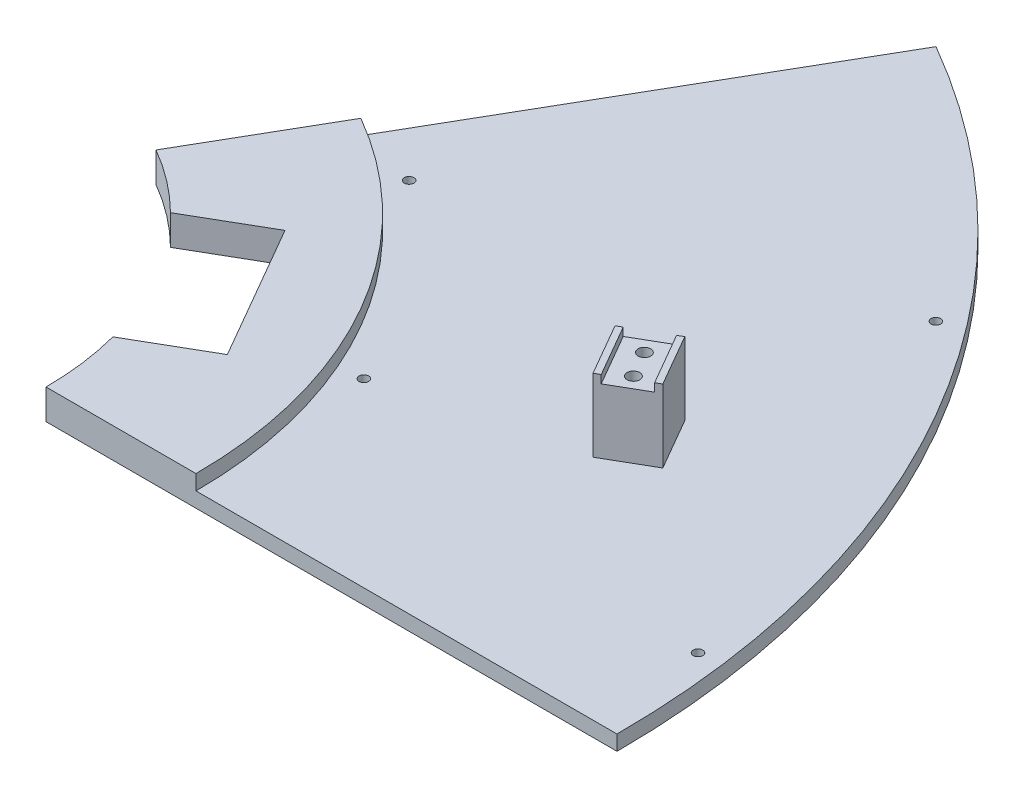
from build123d import *

# Parameters (mm, degrees)
AUFSATZ_LINEAR_AUSTRAGEN1_DEPTH = 5
AUFSATZ_LINEAR_AUSTRAGEN2_DEPTH = 5
SCHNITT_LINEAR_AUSTRAGEN1_DEPTH = 384.76425055
SCHNITT_LINEAR_AUSTRAGEN2_DEPTH = 384.76425055
SKIZZE5_R                       = 1.6
SCHNITT_LINEAR_AUSTRAGEN3_DEPTH = 384.666521865
FASE1_SIZE                      = 2
AUFSATZ_LINEAR_AUSTRAGEN3_DEPTH = 21.5
SKIZZE7_R                       = 2.1
SCHNITT_LINEAR_AUSTRAGEN4_DEPTH = 385.548111424
AUFSATZ_LINEAR_AUSTRAGEN4_DEPTH = 24.2
FASE2_SIZE                      = 2.5


with BuildPart() as part:
    # Skizze1 → Aufsatz-Linear austragen1 (new body)
    with BuildSketch(Plane(origin=(0, 0, 0), x_dir=(1, 0, 0), z_dir=(0, 1, 0))):
        with BuildLine():
            Line((0, 0), (290, 0))
            ThreePointArc((290, 0), (251.147367097, 145), (145, 251.147367097))
            Line((145, 251.147367097), (0, 0))
        make_face()
    extrude(amount=AUFSATZ_LINEAR_AUSTRAGEN1_DEPTH)

    # Skizze2 → Aufsatz-Linear austragen2 (add)
    with BuildSketch(Plane(origin=(0, 5, 0), x_dir=(1, 0, 0), z_dir=(0, 1, 0))):
        with BuildLine():
            Line((0, 0), (149.9, 0))
            ThreePointArc((149.9, 0), (129.817208027, 74.95), (74.95, 129.817208027))
            Line((74.95, 129.817208027), (0, 0))
        make_face()
    extrude(amount=AUFSATZ_LINEAR_AUSTRAGEN2_DEPTH)

    # Skizze3 → Schnitt-Linear austragen1 (cut, through all)
    with BuildSketch(Plane(origin=(0, 10, 0), x_dir=(1, 0, 0), z_dir=(0, 1, 0))):
        Polygon((26.2, 45.379731158), (94.633560231, 84.889865579), (120.833560231, 39.510134421), (52.4, 0), (0, 0), align=None)
    extrude(amount=-SCHNITT_LINEAR_AUSTRAGEN1_DEPTH, mode=Mode.SUBTRACT)

    # Skizze4 → Schnitt-Linear austragen2 (cut, through all)
    with BuildSketch(Plane(origin=(0, 10, 0), x_dir=(1, 0, 0), z_dir=(0, 1, 0))):
        with BuildLine():
            Line((100, 0), (0, 0))
            Line((0, 0), (50, 86.602540378))
            ThreePointArc((50, 86.602540378), (86.602540378, 50), (100, 0))
        make_face()
    extrude(amount=-SCHNITT_LINEAR_AUSTRAGEN2_DEPTH, mode=Mode.SUBTRACT)

    # Skizze5 → Schnitt-Linear austragen3 (cut, through all)
    with BuildSketch(Plane(origin=(0, 5, 0), x_dir=(1, 0, 0), z_dir=(0, 1, 0))):
        with Locations(Location((95.879925069, 124.953151096, 0), (0, 0, 270))):
            Circle(SKIZZE5_R)
        with Locations(Location((224.122318632, 171.975103695, 0), (0, 0, 270))):
            Circle(SKIZZE5_R)
        with Locations(Location((145.511026371, 60.272640598, 0), (0, 0, 270))):
            Circle(SKIZZE5_R)
        with Locations(Location((280.083173338, 36.873649302, 0), (0, 0, 270))):
            Circle(SKIZZE5_R)
    extrude(amount=-SCHNITT_LINEAR_AUSTRAGEN3_DEPTH, mode=Mode.SUBTRACT)

    # Fase1
    fase1_edges = [part.edges().sort_by_distance(p)[0] for p in [
        (95.879925069, 0, -126.553151096),
        (224.122318632, 0, -173.575103695),
        (145.511026371, 0, -61.872640598),
        (280.083173338, 0, -38.473649302),
    ]]
    chamfer(fase1_edges, length=FASE1_SIZE)

    # Skizze6 → Aufsatz-Linear austragen3 (add)
    with BuildSketch(Plane(origin=(0, 5, 0), x_dir=(1, 0, 0), z_dir=(0, 1, 0))):
        Polygon((207.976550727, 76.774047358), (219.234880976, 83.274047358), (209.234880976, 100.594555434), (197.976550727, 94.094555434), align=None)
    extrude(amount=AUFSATZ_LINEAR_AUSTRAGEN3_DEPTH)

    # Skizze7 → Schnitt-Linear austragen4 (cut, through all)
    with BuildSketch(Plane(origin=(0, 26.5, 0), x_dir=(1, 0, 0), z_dir=(0, 1, 0))):
        with Locations(Location((206.105715851, 93.014428415, 0), (0, 0, 270))):
            Circle(SKIZZE7_R)
        with Locations(Location((211.105715851, 84.354174377, 0), (0, 0, 270))):
            Circle(SKIZZE7_R)
    extrude(amount=-SCHNITT_LINEAR_AUSTRAGEN4_DEPTH, mode=Mode.SUBTRACT)

    # Skizze9 → Aufsatz-Linear austragen4 (add)
    with BuildSketch(Plane(origin=(0, 5, 0), x_dir=(1, 0, 0), z_dir=(0, 1, 0))):
        Polygon((197.976550727, 94.094555434), (207.976550727, 76.774047358), (206.244499919, 75.774047358), (196.244499919, 93.094555434), align=None)
        Polygon((219.234880976, 83.274047358), (220.966931784, 84.274047358), (210.966931784, 101.594555434), (209.234880976, 100.594555434), align=None)
    extrude(amount=AUFSATZ_LINEAR_AUSTRAGEN4_DEPTH)

    # Fase2
    fase2_edges = [part.edges().sort_by_distance(p)[0] for p in [
        (206.105715851, 0, -95.114428415),
        (211.105715851, 0, -86.454174377),
    ]]
    chamfer(fase2_edges, length=FASE2_SIZE)


solid = part.part
